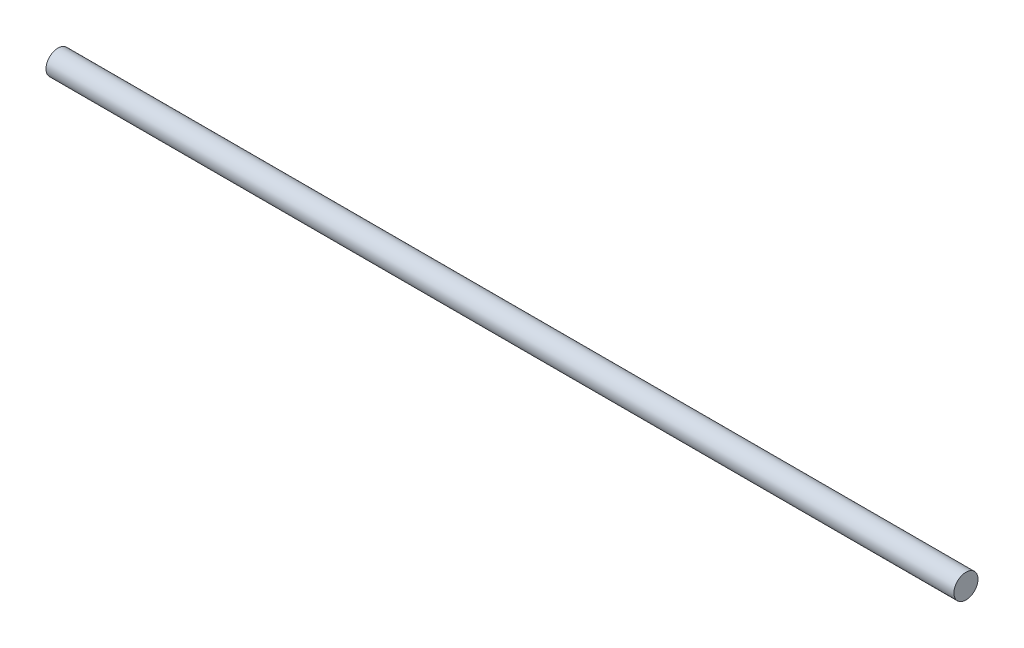
from build123d import *

# Parameters (mm, degrees)
EXTRUSION1_DEPTH      = 60
EXTRUSION1_DEPTH_BACK = 53
ESQUISSE1_R           = 1.5


with BuildPart() as part:
    # Esquisse1 → Extrusion1 (new, two sides: drawn at the far end of the back side and taken through both)
    with BuildSketch(Plane(origin=(0, 0, 0), x_dir=(0, 0, -1), z_dir=(1, 0, 0)).offset(-EXTRUSION1_DEPTH_BACK)):
        Circle(ESQUISSE1_R)
    extrude(amount=EXTRUSION1_DEPTH + EXTRUSION1_DEPTH_BACK)


solid = part.part
